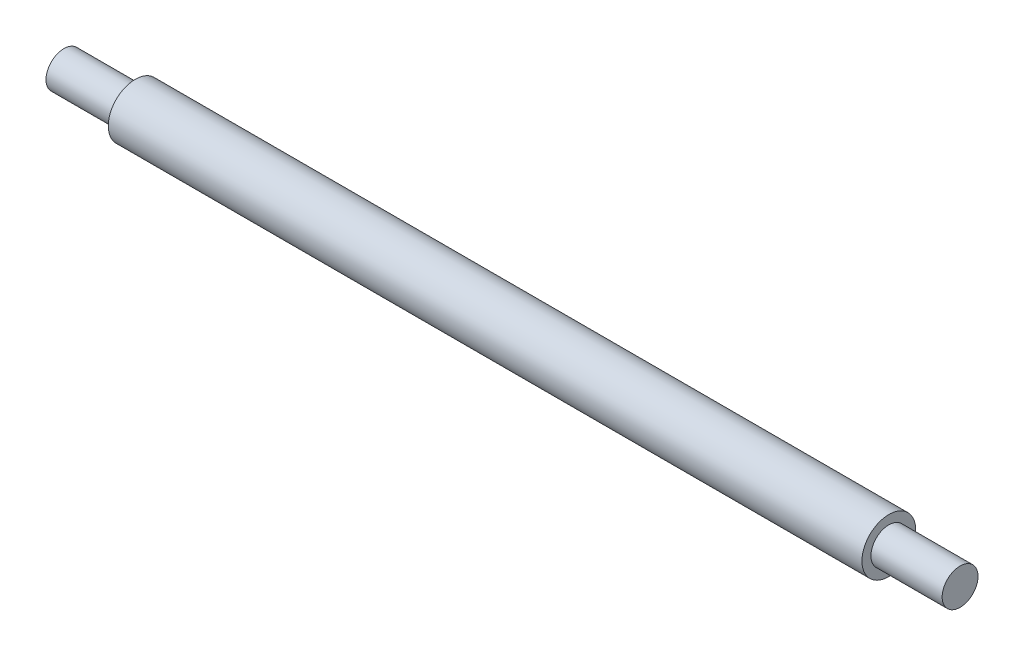
from build123d import *


with BuildPart() as part:
    # Sketch1 → Revolve1 (revolve)
    with BuildSketch(Plane.XY, mode=Mode.PRIVATE) as revolve1_sk:
        Polygon((0, 0), (0, 2), (7.94, 2), (7.94, 3), (91.94, 3), (91.94, 2), (99.88, 2), (99.88, 0), align=None)
    revolve(revolve1_sk.sketch.rotate(Axis((-15.28144705, 0, 0), (1, 0, 0)), 90), axis=Axis((-15.28144705, 0, 0), (1, 0, 0)))


solid = part.part
